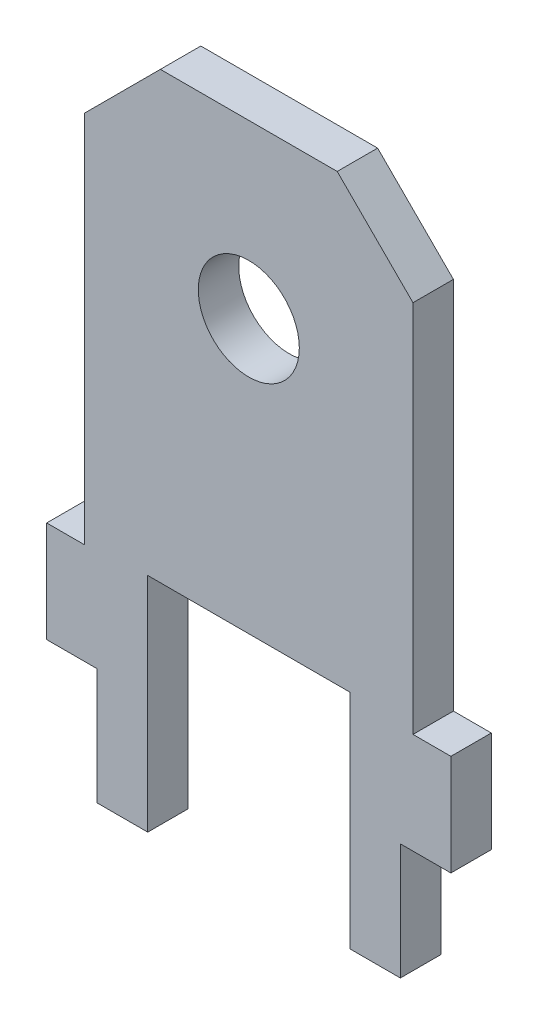
from build123d import *

# Parameters (mm, degrees)
SKETCH_1_R          = 1
EXTRUDE_1_DEPTH     = 0.8
SKETCH_2_R          = 0.25
CUT_EXTRUDE_1_DEPTH = 3


with BuildPart() as part:
    # Эскиз1 → Вытянуть1 (new body)
    with BuildSketch(Plane.XY):
        Polygon((2, 12.549502762), (3, 12.549502762), (3, 14.849502762), (4, 14.849502762), (4, 16.849502762), (3.25, 16.849502762), (3.25, 24.249502762), (1.75, 25.749502762), (-1.75, 25.749502762), (-3.25, 24.249502762), (-3.25, 16.849502762), (-4, 16.849502762), (-4, 14.849502762), (-3, 14.849502762), (-3, 12.549502762), (-2, 12.549502762), (-2, 16.949502762), (2, 16.949502762), align=None)
        with Locations((0, 22.349502762)):
            Circle(SKETCH_1_R, mode=Mode.SUBTRACT)
    extrude(amount=EXTRUDE_1_DEPTH)

    # Эскиз2 → Вырез-Вытянуть1 (cut)
    with BuildSketch(Plane.XZ.offset(-12.549502762)):
        with Locations(Location((2.5, 0.4, 0), (0, 0, 270))):
            Circle(SKETCH_2_R)
        with Locations(Location((-2.5, 0.4, 0), (0, 0, 90))):
            Circle(SKETCH_2_R)
    extrude(amount=-CUT_EXTRUDE_1_DEPTH, mode=Mode.SUBTRACT)


solid = part.part
